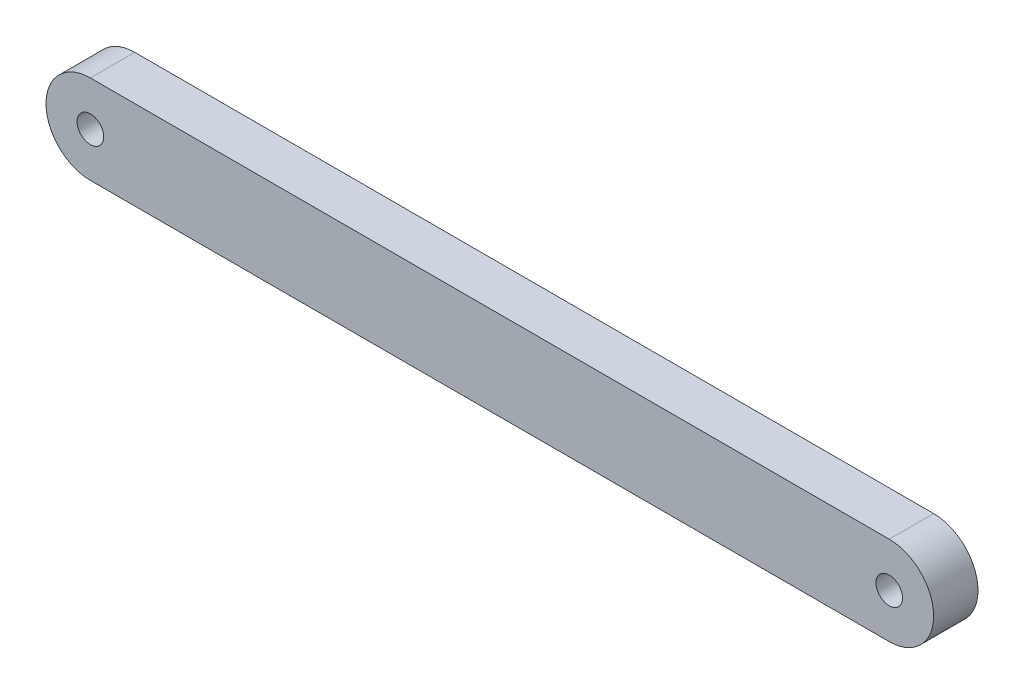
from build123d import *

# Parameters (mm, degrees)
ESQUISSE1_R        = 1.5
BOSS_EXTRU_1_DEPTH = 5


with BuildPart() as part:
    # Esquisse1 → Boss.-Extru.1 (new body)
    with BuildSketch(Plane.XY):
        with BuildLine():
            Line((-45, 5), (45, 5))
            ThreePointArc((45, 5), (50, 0), (45, -5))
            Line((45, -5), (-45, -5))
            ThreePointArc((-45, -5), (-50, 0), (-45, 5))
        make_face()
        with Locations((-45, 0)):
            Circle(ESQUISSE1_R, mode=Mode.SUBTRACT)
        with Locations((45, 0)):
            Circle(ESQUISSE1_R, mode=Mode.SUBTRACT)
    extrude(amount=BOSS_EXTRU_1_DEPTH)


solid = part.part
